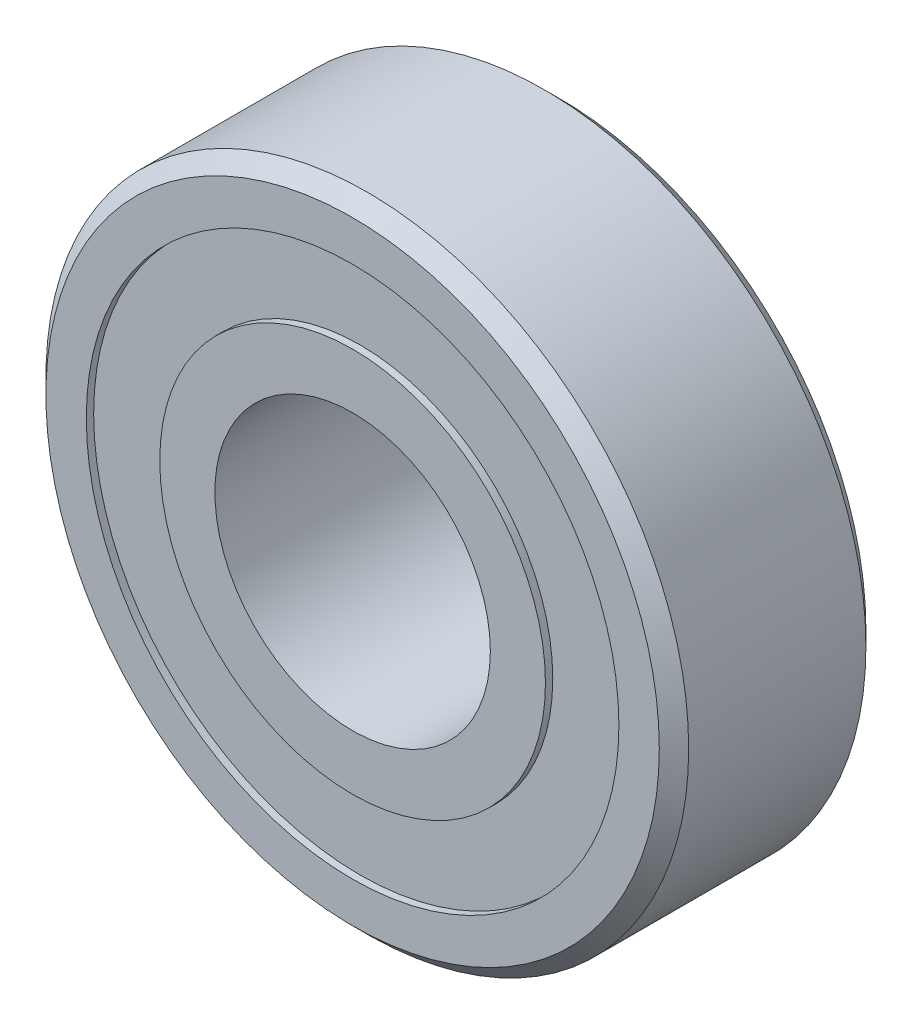
from build123d import *

# Parameters (mm, degrees)
SKETCH1_R                    = 11.1125
BOSS_EXTRUDE1_DEPTH          = 7.14375
CHAMFER1_SIZE                = 0.508
F_3_8_0_375_DIAMETER_HOLE1_D = 9.525
SKETCH5_R                    = 9.2075
SKETCH5_R_2                  = 6.6675
CUT_EXTRUDE1_DEPTH           = 0.254
CUT_EXTRUDE2_START           = -0.254
SKETCH6_R                    = 9.2075
SKETCH6_R_2                  = 6.6675
CUT_EXTRUDE2_DEPTH           = 0.254


with BuildPart() as part:
    # Sketch1 → Boss-Extrude1 (new body)
    with BuildSketch(Plane.XY):
        Circle(SKETCH1_R)
    extrude(amount=BOSS_EXTRUDE1_DEPTH)

    # Chamfer1
    chamfer1_edges = [part.edges().sort_by_distance(p)[0] for p in [
        (-11.1125, 0, 0),
        (-11.1125, 0, 7.14375),
    ]]
    chamfer(chamfer1_edges, length=CHAMFER1_SIZE)

    # 3/8 (0.375) Diameter Hole1 (through all)
    with Locations(Plane.XY.offset(7.14375)):
        with Locations((0, 0)):
            Hole(F_3_8_0_375_DIAMETER_HOLE1_D / 2)

    # Sketch5 → Cut-Extrude1 (cut)
    with BuildSketch(Plane.XY.offset(7.14375)):
        Circle(SKETCH5_R)
        Circle(SKETCH5_R_2, mode=Mode.SUBTRACT)
    extrude(amount=-CUT_EXTRUDE1_DEPTH, mode=Mode.SUBTRACT)

    # Sketch6 → Cut-Extrude2 (cut)
    with BuildSketch(Plane(origin=(0, 0, 0), x_dir=(-1, 0, 0), z_dir=(0, 0, -1)).offset(CUT_EXTRUDE2_START)):
        with Locations(Location((0, 0, 0), (0, 0, 180))):
            Circle(SKETCH6_R)
        with Locations(Location((0, 0, 0), (0, 0, 180))):
            Circle(SKETCH6_R_2, mode=Mode.SUBTRACT)
    extrude(amount=CUT_EXTRUDE2_DEPTH, mode=Mode.SUBTRACT)


solid = part.part
